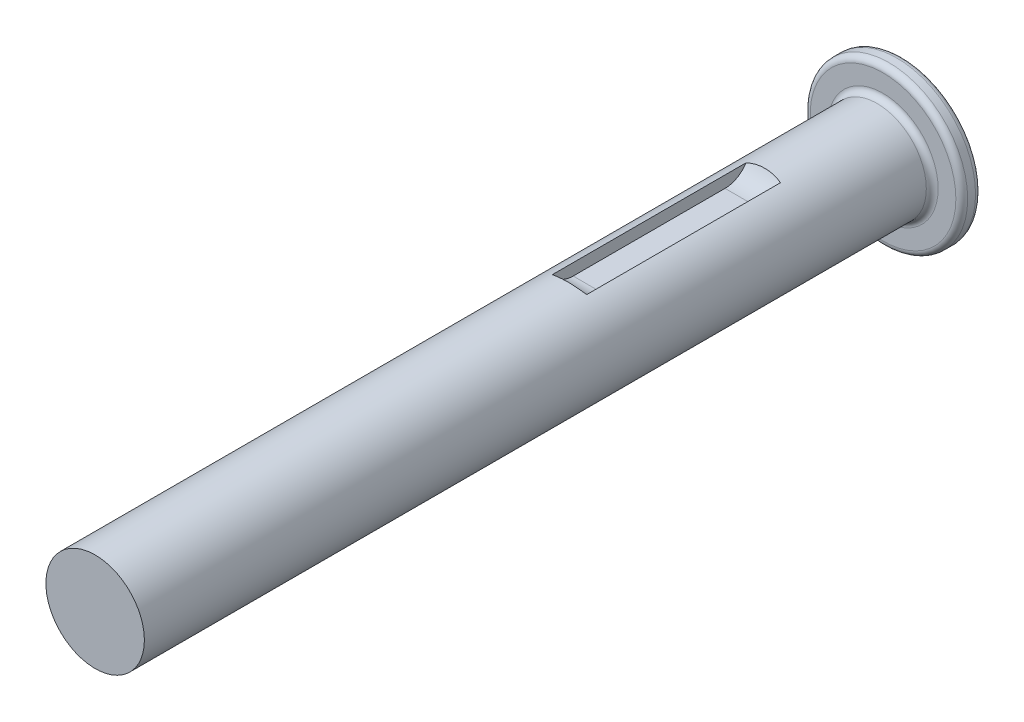
from build123d import *

# Parameters (mm, degrees)
SKETCH1_R           = 8
BOSS_EXTRUDE1_DEPTH = 2
SKETCH2_R           = 5
BOSS_EXTRUDE2_DEPTH = 80
CUT_EXTRUDE1_DEPTH  = 1.75
FILLET2_R           = 0.6


with BuildPart() as part:
    # Sketch1 → Boss-Extrude1 (new body)
    with BuildSketch(Plane.XY):
        Circle(SKETCH1_R)
    extrude(amount=BOSS_EXTRUDE1_DEPTH)

    # Sketch2 → Boss-Extrude2 (add)
    with BuildSketch(Plane.XY.offset(2)):
        Circle(SKETCH2_R)
    extrude(amount=BOSS_EXTRUDE2_DEPTH)

    # Sketch4 → Cut-Extrude1 (cut, symmetric)
    with BuildSketch(Plane(origin=(0, 0, 0), x_dir=(0, 0, -1), z_dir=(1, 0, 0))):
        with BuildLine():
            Line((-34, 5), (-14, 5))
            ThreePointArc((-14, 5), (-14.921981454, 3.908349934), (-16.291287847, 3.5))
            Line((-16.291287847, 3.5), (-31.708712153, 3.5))
            ThreePointArc((-31.708712153, 3.5), (-33.078018546, 3.908349934), (-34, 5))
        make_face()
    extrude(amount=CUT_EXTRUDE1_DEPTH, both=True, mode=Mode.SUBTRACT)

    # Fillet2
    fillet2_edges = [part.edges().sort_by_distance(p)[0] for p in [
        (-8, 0, 0),
        (-8, 0, 2),
        (-5, 0, 2),
    ]]
    fillet(fillet2_edges, radius=FILLET2_R)


solid = part.part
